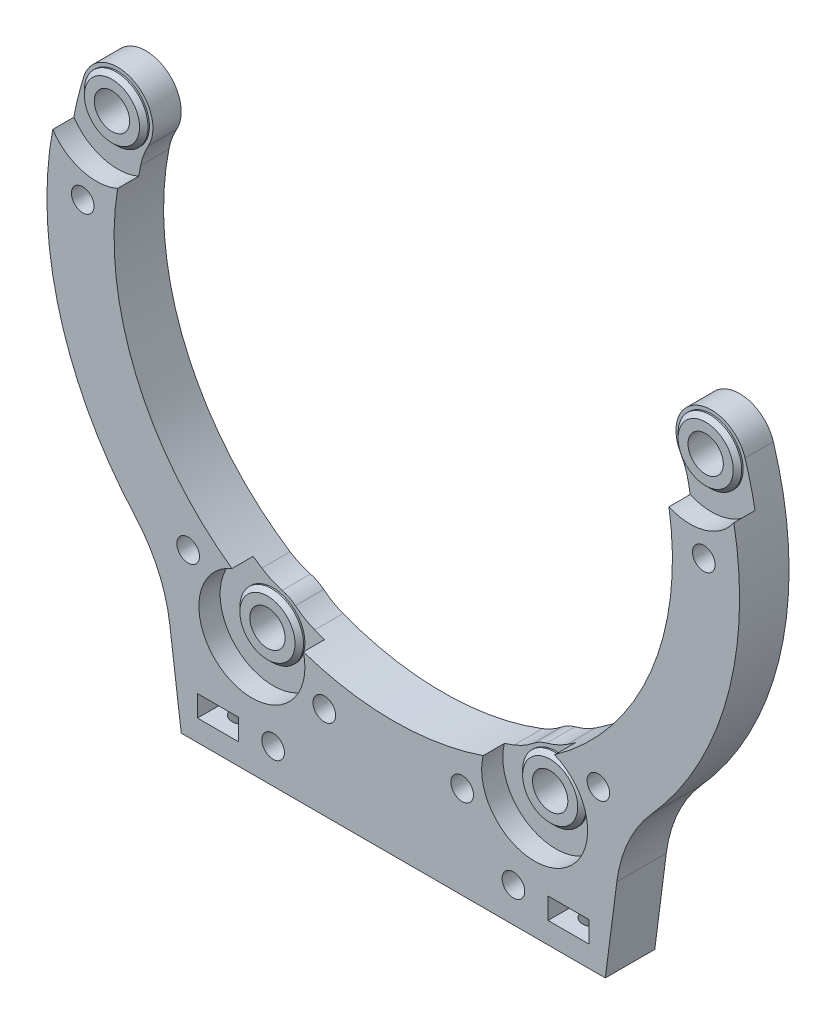
from build123d import *

# Parameters (mm, degrees)
SKETCH1_R           = 2.5
BOSS_EXTRUDE1_DEPTH = 4
SKETCH2_R           = 4.5
SKETCH2_R_2         = 2.5
BOSS_EXTRUDE2_DEPTH = 0.8
CHAMFER1_SIZE       = 0.6
BOSS_EXTRUDE3_DEPTH = 3
FILLET1_R           = 10
FILLET2_R           = 20
SKETCH4_R           = 1.6
CUT_EXTRUDE1_DEPTH  = 9
SKETCH5_W           = 5.8
SKETCH5_H           = 3
CUT_EXTRUDE2_DEPTH  = 75.739547914
SKETCH6_R           = 1.6
CUT_EXTRUDE3_DEPTH  = 75.739547914
CUT_EXTRUDE4_DEPTH  = 2.5
SKETCH8_R           = 1.6
BOSS_EXTRUDE4_DEPTH = 0.3


with BuildPart() as part:
    # Sketch1 → Boss-Extrude1 (new body)
    with BuildSketch(Plane.XY):
        with BuildLine():
            Line((-30, -56), (30, -56))
            Line((30, -56), (32.5, -36.670833097))
            ThreePointArc((32.5, -36.670833097), (47.205395025, -13.139660596), (46.772727217, 14.605204166))
            ThreePointArc((46.772727217, 14.605204166), (39.535323856, 17.465207094), (38.268314934, 9.787035922))
            ThreePointArc((38.268314934, 9.787035922), (36.410539457, -15.314131268), (19.768721557, -34.197187721))
            ThreePointArc((19.768721557, -34.197187721), (17.727272727, -34.73821817), (16.091299104, -36.073814508))
            ThreePointArc((16.091299104, -36.073814508), (0, -39.5), (-16.091299104, -36.073814508))
            ThreePointArc((-16.091299104, -36.073814508), (-17.727272727, -34.73821817), (-19.768721557, -34.197187721))
            ThreePointArc((-19.768721557, -34.197187721), (-36.410539457, -15.314131268), (-38.268314934, 9.787035922))
            ThreePointArc((-38.268314934, 9.787035922), (-39.535323938, 17.465207141), (-46.772727273, 14.605203985))
            ThreePointArc((-46.772727273, 14.605203985), (-47.205394999, -13.139660687), (-32.5, -36.670833097))
            Line((-32.5, -36.670833097), (-30, -56))
        make_face()
        with Locations((20, -39.191835885)):
            Circle(SKETCH1_R, mode=Mode.SUBTRACT)
        with Locations((42, 13.114877049)):
            Circle(SKETCH1_R, mode=Mode.SUBTRACT)
        with Locations((-20, -39.191835885)):
            Circle(SKETCH1_R, mode=Mode.SUBTRACT)
        with Locations((-42, 13.114877049)):
            Circle(SKETCH1_R, mode=Mode.SUBTRACT)
    extrude(amount=BOSS_EXTRUDE1_DEPTH)

    # Sketch2 → Boss-Extrude2 (add)
    # profile 1 of 4: a face of its own
    with BuildSketch(Plane.XY.offset(4)):
        with Locations((-42, 13.114877049)):
            Circle(SKETCH2_R)
        with Locations((-42, 13.114877049)):
            Circle(SKETCH2_R_2, mode=Mode.SUBTRACT)
    # profile 2 of 4: a face of its own
    with BuildSketch(Plane.XY.offset(4)):
        with Locations((42, 13.114877049)):
            Circle(SKETCH2_R)
        with Locations((42, 13.114877049)):
            Circle(SKETCH2_R_2, mode=Mode.SUBTRACT)
    # profile 3 of 4: a face of its own
    with BuildSketch(Plane.XY.offset(4)):
        with Locations((-20, -39.191835885)):
            Circle(SKETCH2_R)
        with Locations((-20, -39.191835885)):
            Circle(SKETCH2_R_2, mode=Mode.SUBTRACT)
    # profile 4 of 4: a face of its own
    with BuildSketch(Plane.XY.offset(4)):
        with Locations((20, -39.191835885)):
            Circle(SKETCH2_R)
        with Locations((20, -39.191835885)):
            Circle(SKETCH2_R_2, mode=Mode.SUBTRACT)
    extrude(amount=BOSS_EXTRUDE2_DEPTH)

    # Chamfer1
    chamfer1_edges = [part.edges().sort_by_distance(p)[0] for p in [
        (-46.5, 13.114877049, 4.8),
        (37.5, 13.114877049, 4.8),
        (-24.5, -39.191835885, 4.8),
        (15.5, -39.191835885, 4.8),
    ]]
    chamfer(chamfer1_edges, length=CHAMFER1_SIZE)

    # Sketch3 → Boss-Extrude3 (add)
    with BuildSketch(Plane.XY.offset(4)):
        with BuildLine():
            Line((-32.5, -36.670833097), (-30, -56))
            Line((-30, -56), (30, -56))
            Line((30, -56), (32.5, -36.670833097))
            ThreePointArc((32.5, -36.670833097), (46.328829959, -15.957428197), (48.188928345, 8.878467491))
            ThreePointArc((48.188928345, 8.878467491), (44.071309785, 5.906571022), (39.004130968, 6.239212081))
            ThreePointArc((39.004130968, 6.239212081), (36.410539457, -15.314131268), (22.819148844, -32.241843093))
            ThreePointArc((22.819148844, -32.241843093), (26.220675861, -35.002182935), (27.5, -39.191835885))
            ThreePointArc((27.5, -39.191835885), (19.095757418, -46.63712603), (12.718041239, -37.396542982))
            ThreePointArc((12.718041239, -37.396542982), (0, -39.5), (-12.718041239, -37.396542982))
            ThreePointArc((-12.718041239, -37.396542982), (-12.554709854, -38.287593303), (-12.5, -39.191835885))
            ThreePointArc((-12.5, -39.191835885), (-24.189652949, -45.412511745), (-22.819148844, -32.241843093))
            ThreePointArc((-22.819148844, -32.241843093), (-36.410539457, -15.314131268), (-39.004130968, 6.239212081))
            ThreePointArc((-39.004130968, 6.239212081), (-44.071309785, 5.906571022), (-48.188928345, 8.878467491))
            ThreePointArc((-48.188928345, 8.878467491), (-46.328829959, -15.957428197), (-32.5, -36.670833097))
        make_face()
    extrude(amount=BOSS_EXTRUDE3_DEPTH)

    # Fillet1
    fillet1_edges = [part.edges().sort_by_distance(p)[0] for p in [
        (38.268314934, 9.787035922, 2),
        (-38.268314934, 9.787035922, 2),
        (-19.768721557, -34.197187721, 2),
        (-16.091299104, -36.073814508, 2),
        (16.091299104, -36.073814508, 2),
        (19.768721557, -34.197187721, 2),
    ]]
    fillet(fillet1_edges, radius=FILLET1_R)

    # Fillet2
    fillet2_edges = [part.edges().sort_by_distance(p)[0] for p in [
        (32.5, -36.670833097, 3.5),
        (-32.5, -36.670833097, 3.5),
    ]]
    fillet(fillet2_edges, radius=FILLET2_R)

    # Sketch4 → Cut-Extrude1 (cut)
    with BuildSketch(Plane.XZ.offset(56)):
        with Locations(Location((24.8, 3.4, 0), (0, 0, 270))):
            Circle(SKETCH4_R)
        with Locations(Location((-24.8, 3.4, 0), (0, 0, 270))):
            Circle(SKETCH4_R)
    extrude(amount=-CUT_EXTRUDE1_DEPTH, mode=Mode.SUBTRACT)

    # Sketch5 → Cut-Extrude2 (cut, through all)
    with BuildSketch(Plane.XY.offset(7)):
        with Locations((-24.8, -51.5)):
            Rectangle(SKETCH5_W, SKETCH5_H)
        with Locations((24.8, -51.5)):
            Rectangle(SKETCH5_W, SKETCH5_H)
    extrude(amount=-CUT_EXTRUDE2_DEPTH, mode=Mode.SUBTRACT)

    # Sketch6 → Cut-Extrude3 (cut, through all)
    with BuildSketch(Plane(origin=(0, 0, 0), x_dir=(-1, 0, 0), z_dir=(0, 0, -1))):
        with Locations((29.020432882, -33.072866149)):
            Circle(SKETCH6_R)
        with Locations((43.935148821, 2.388032264)):
            Circle(SKETCH6_R)
        with Locations((-17, -51.1)):
            Circle(SKETCH6_R)
        with Locations((17, -51.1)):
            Circle(SKETCH6_R)
        with Locations((9.752191085, -42.905649617)):
            Circle(SKETCH6_R)
        with Locations((-43.935148821, 2.388032264)):
            Circle(SKETCH6_R)
        with Locations((-29.020432882, -33.072866149)):
            Circle(SKETCH6_R)
        with Locations((-9.752191085, -42.905649617)):
            Circle(SKETCH6_R)
    extrude(amount=-CUT_EXTRUDE3_DEPTH, mode=Mode.SUBTRACT)

    # Sketch7 → Cut-Extrude4 (cut)
    with BuildSketch(Plane(origin=(0, 0, 0), x_dir=(-1, 0, 0), z_dir=(0, 0, -1))):
        Polygon((-40.639712949, 1.793527638), (-41.772574777, 4.944711132), (-45.068010648, 5.539215758), (-47.230584692, 2.982536889), (-46.097722865, -0.168646605), (-42.802286993, -0.76315123), align=None)
        Polygon((-27.140600297, -30.301663742), (-30.480448274, -30.059282172), (-32.360280859, -32.83048458), (-30.900265467, -35.844068557), (-27.56041749, -36.086450127), (-25.680584905, -33.315247719), align=None)
        Polygon((-8.611255867, -39.757380225), (-11.908204747, -40.343436038), (-13.049139965, -43.49170543), (-10.893126303, -46.053919008), (-7.596177423, -45.467863196), (-6.455242205, -42.319593804), align=None)
        Polygon((-14.1, -49.425684219), (-17, -47.751368439), (-19.9, -49.425684219), (-19.9, -52.774315781), (-17, -54.448631561), (-14.1, -52.774315781), align=None)
        Polygon((14.1, -52.774315781), (14.1, -49.425684219), (17, -47.751368439), (19.9, -49.425684219), (19.9, -52.774315781), (17, -54.448631561), align=None)
        Polygon((6.455242205, -42.319593804), (8.611255867, -39.757380225), (11.908204747, -40.343436038), (13.049139965, -43.49170543), (10.893126303, -46.053919008), (7.596177423, -45.467863196), align=None)
        Polygon((25.680584905, -33.315247719), (27.140600297, -30.301663742), (30.480448274, -30.059282172), (32.360280859, -32.83048458), (30.900265467, -35.844068557), (27.56041749, -36.086450127), align=None)
        Polygon((42.802286993, -0.76315123), (40.639712949, 1.793527638), (41.772574777, 4.944711132), (45.068010648, 5.539215758), (47.230584692, 2.982536889), (46.097722865, -0.168646605), align=None)
    extrude(amount=-CUT_EXTRUDE4_DEPTH, mode=Mode.SUBTRACT)

    # Sketch8 → Boss-Extrude4 (add)
    with BuildSketch(Plane(origin=(0, 0, 2.5), x_dir=(-1, 0, 0), z_dir=(0, 0, -1))):
        with Locations((43.935148821, 2.388032264)):
            Circle(SKETCH8_R)
        with Locations((29.020432882, -33.072866149)):
            Circle(SKETCH8_R)
        with Locations((17, -51.1)):
            Circle(SKETCH8_R)
        with Locations((9.752191085, -42.905649617)):
            Circle(SKETCH8_R)
        with Locations((-17, -51.1)):
            Circle(SKETCH8_R)
        with Locations((-9.752191085, -42.905649617)):
            Circle(SKETCH8_R)
        with Locations((-29.020432882, -33.072866149)):
            Circle(SKETCH8_R)
        with Locations((-43.935148821, 2.388032264)):
            Circle(SKETCH8_R)
    extrude(amount=-BOSS_EXTRUDE4_DEPTH)


solid = part.part
